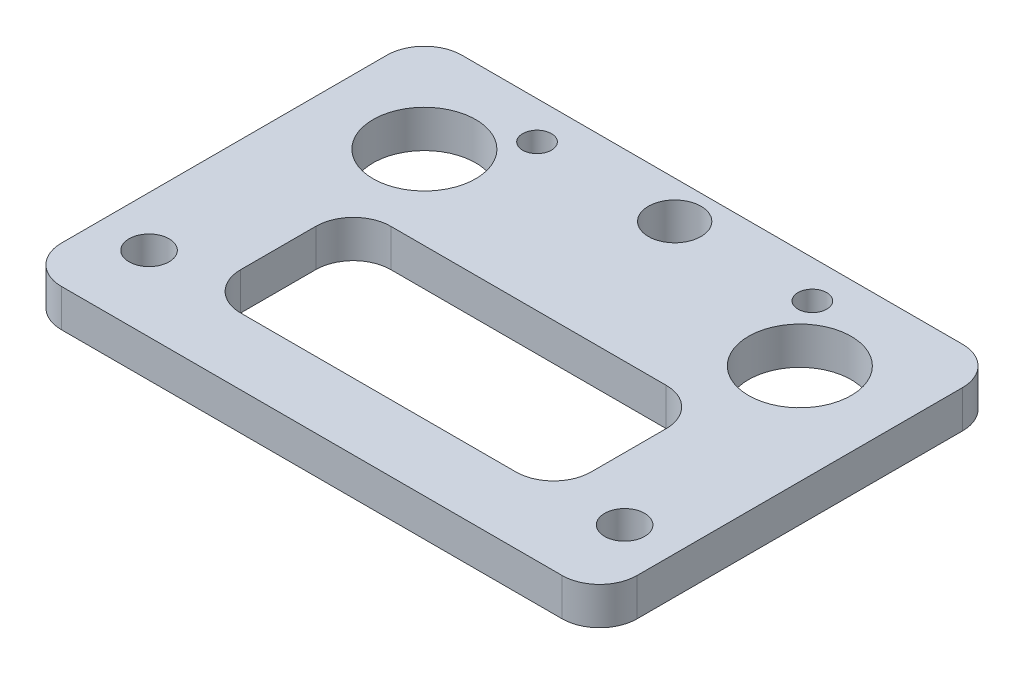
from build123d import *

# Parameters (mm, degrees)
SKETCH_4_W          = 46
SKETCH_4_H          = 16
EXTRUDE_3_DEPTH     = 3
CUT_EXTRUDE_1_REACH = 26.536
SKETCH_5_R          = 4.1
SKETCH_6_W          = 46
SKETCH_6_H          = 3
EXTRUDE_4_DEPTH     = 16
CUT_EXTRUDE_2_REACH = 35.377
SKETCH_9_R          = 1.6
CUT_EXTRUDE_4_REACH = 35.377
SKETCH_11_R         = 1.15
SKETCH_11_R_2       = 2.1
CUT_EXTRUDE_5_REACH = 35.377
SKETCH_12_W         = 28
SKETCH_12_H         = 12
FILLET_3_R          = 3


with BuildPart() as part:
    # 草图4 → 凸台-拉伸3 (new body)
    with BuildSketch(Plane(origin=(0, 0, 0), x_dir=(1, 0, 0), z_dir=(0, 1, 0))):
        Rectangle(SKETCH_4_W, SKETCH_4_H)
    extrude(amount=EXTRUDE_3_DEPTH)

    # 草图5 → 切除-拉伸1 (cut, up to next)
    with BuildSketch(Plane(origin=(0, 3, 0), x_dir=(1, 0, 0), z_dir=(0, 1, 0)), mode=Mode.PRIVATE) as cut_extrude_1_sk1:
        with Locations(Location((-15, 0, 0), (0, 0, 270))):
            Circle(SKETCH_5_R)
    cut_extrude_1_tool1 = extrude(cut_extrude_1_sk1.sketch, amount=-CUT_EXTRUDE_1_REACH, mode=Mode.PRIVATE) & part.part
    # 草图5 → 切除-拉伸1 (cut, up to next)
    with BuildSketch(Plane(origin=(0, 3, 0), x_dir=(1, 0, 0), z_dir=(0, 1, 0)), mode=Mode.PRIVATE) as cut_extrude_1_sk2:
        with Locations(Location((15, 0, 0), (0, 0, 270))):
            Circle(SKETCH_5_R)
    cut_extrude_1_tool2 = extrude(cut_extrude_1_sk2.sketch, amount=-CUT_EXTRUDE_1_REACH, mode=Mode.PRIVATE) & part.part
    add(cut_extrude_1_tool1.solids().sort_by_distance((-15, 3, 0))[0], mode=Mode.SUBTRACT)
    add(cut_extrude_1_tool2.solids().sort_by_distance((15, 3, 0))[0], mode=Mode.SUBTRACT)

    # 草图6 → 凸台-拉伸4 (add)
    with BuildSketch(Plane.XY.offset(8)):
        with Locations((0, 1.5)):
            Rectangle(SKETCH_6_W, SKETCH_6_H)
    extrude(amount=EXTRUDE_4_DEPTH)

    # 草图9 → 切除-拉伸2 (cut, up to next)
    with BuildSketch(Plane(origin=(0, 3, 0), x_dir=(1, 0, 0), z_dir=(0, 1, 0)), mode=Mode.PRIVATE) as cut_extrude_2_sk1:
        with Locations(Location((-19, -18, 0), (0, 0, 270))):
            Circle(SKETCH_9_R)
    cut_extrude_2_tool1 = extrude(cut_extrude_2_sk1.sketch, amount=-CUT_EXTRUDE_2_REACH, mode=Mode.PRIVATE) & part.part
    # 草图9 → 切除-拉伸2 (cut, up to next)
    with BuildSketch(Plane(origin=(0, 3, 0), x_dir=(1, 0, 0), z_dir=(0, 1, 0)), mode=Mode.PRIVATE) as cut_extrude_2_sk2:
        with Locations(Location((19, -18, 0), (0, 0, 270))):
            Circle(SKETCH_9_R)
    cut_extrude_2_tool2 = extrude(cut_extrude_2_sk2.sketch, amount=-CUT_EXTRUDE_2_REACH, mode=Mode.PRIVATE) & part.part
    add(cut_extrude_2_tool1.solids().sort_by_distance((-19, 3, 18))[0], mode=Mode.SUBTRACT)
    add(cut_extrude_2_tool2.solids().sort_by_distance((19, 3, 18))[0], mode=Mode.SUBTRACT)

    # 草图11 → 切除-拉伸4 (cut, up to next)
    with BuildSketch(Plane(origin=(0, 3, 0), x_dir=(1, 0, 0), z_dir=(0, 1, 0)), mode=Mode.PRIVATE) as cut_extrude_4_sk1:
        with Locations(Location((-11, 5, 0), (0, 0, 270))):
            Circle(SKETCH_11_R)
    cut_extrude_4_tool1 = extrude(cut_extrude_4_sk1.sketch, amount=-CUT_EXTRUDE_4_REACH, mode=Mode.PRIVATE) & part.part
    # 草图11 → 切除-拉伸4 (cut, up to next)
    with BuildSketch(Plane(origin=(0, 3, 0), x_dir=(1, 0, 0), z_dir=(0, 1, 0)), mode=Mode.PRIVATE) as cut_extrude_4_sk2:
        with Locations(Location((11, 5, 0), (0, 0, 270))):
            Circle(SKETCH_11_R)
    cut_extrude_4_tool2 = extrude(cut_extrude_4_sk2.sketch, amount=-CUT_EXTRUDE_4_REACH, mode=Mode.PRIVATE) & part.part
    # 草图11 → 切除-拉伸4 (cut, up to next)
    with BuildSketch(Plane(origin=(0, 3, 0), x_dir=(1, 0, 0), z_dir=(0, 1, 0)), mode=Mode.PRIVATE) as cut_extrude_4_sk3:
        with Locations(Location((0, 5, 0), (0, 0, 270))):
            Circle(SKETCH_11_R_2)
    cut_extrude_4_tool3 = extrude(cut_extrude_4_sk3.sketch, amount=-CUT_EXTRUDE_4_REACH, mode=Mode.PRIVATE) & part.part
    add(cut_extrude_4_tool1.solids().sort_by_distance((-11, 3, -5))[0], mode=Mode.SUBTRACT)
    add(cut_extrude_4_tool2.solids().sort_by_distance((11, 3, -5))[0], mode=Mode.SUBTRACT)
    add(cut_extrude_4_tool3.solids().sort_by_distance((0, 3, -5))[0], mode=Mode.SUBTRACT)

    # 草图12 → 切除-拉伸5 (cut, up to next)
    with BuildSketch(Plane(origin=(0, 3, 0), x_dir=(1, 0, 0), z_dir=(0, 1, 0)), mode=Mode.PRIVATE) as cut_extrude_5_sk1:
        with Locations((0, -12.680818863)):
            Rectangle(SKETCH_12_W, SKETCH_12_H)
    cut_extrude_5_tool1 = extrude(cut_extrude_5_sk1.sketch, amount=-CUT_EXTRUDE_5_REACH, mode=Mode.PRIVATE) & part.part
    add(cut_extrude_5_tool1.solids().sort_by_distance((0, 3, 12.680819))[0], mode=Mode.SUBTRACT)

    # 圆角3
    fillet_3_edges = [part.edges().sort_by_distance(p)[0] for p in [
        (-23, 1.5, 24),
        (23, 1.5, 24),
        (14, 1.5, 6.680818863),
        (14, 1.5, 18.680818863),
        (-14, 1.5, 18.680818863),
        (-14, 1.5, 6.680818863),
        (-23, 1.5, -8),
        (23, 1.5, -8),
    ]]
    fillet(fillet_3_edges, radius=FILLET_3_R)


solid = part.part
